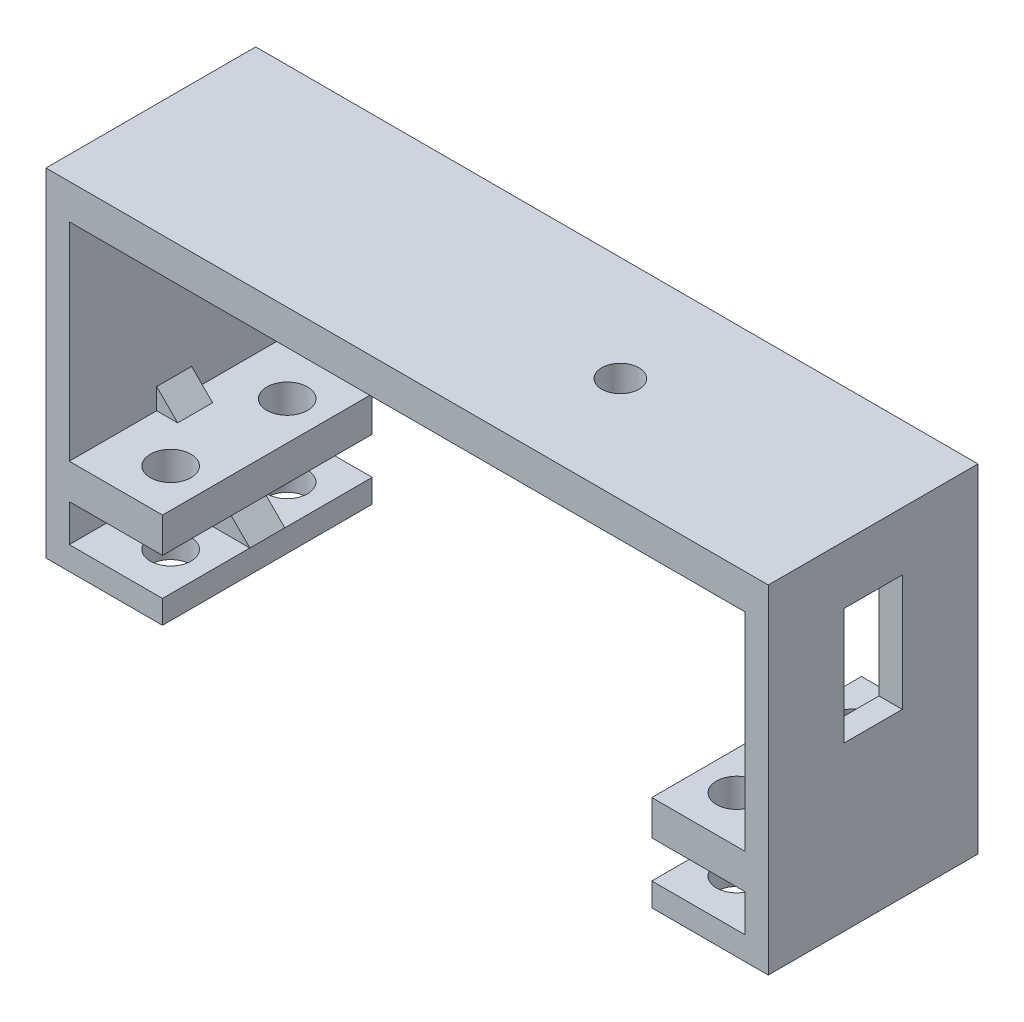
from build123d import *

# Parameters (mm, degrees)
RESSALTO_EXTRUS_O1_DEPTH = 9
ESBO_O2_R                = 1.75
CORTE_EXTRUS_O1_DEPTH    = 16
RESSALTO_EXTRUS_O3_DEPTH = 1.5
ESBO_O6_R                = 1.6
CORTE_EXTRUS_O2_DEPTH    = 3
ESBO_O7_W                = 5
ESBO_O7_H                = 10
CORTE_EXTRUS_O3_DEPTH    = 10
RESSALTO_EXTRUS_O4_START = 3.2
ESBO_O8_W                = 8
ESBO_O8_H                = 18
ESBO_O8_R                = 1.75
RESSALTO_EXTRUS_O4_DEPTH = 3


with BuildPart() as part:
    # Esboço1 → Ressalto-extrusão1 (new, symmetric)
    with BuildSketch(Plane.XY):
        Polygon((-21, 0), (-31, 0), (-31, 29), (31, 29), (31, 0), (21, 0), (21, 2), (29, 2), (29, 26), (-29, 26), (-29, 2), (-21, 2), align=None)
    extrude(amount=RESSALTO_EXTRUS_O1_DEPTH, both=True)

    # Esboço2 → Corte-extrusão1 (cut)
    with BuildSketch(Plane.XZ):
        with Locations(Location((-24.3, -5, 0), (0, 0, 270))):
            Circle(ESBO_O2_R)
        with Locations(Location((-24.3, 5, 0), (0, 0, 270))):
            Circle(ESBO_O2_R)
        with Locations(Location((24.3, 5, 0), (0, 0, 270))):
            Circle(ESBO_O2_R)
        with Locations(Location((24.3, -5, 0), (0, 0, 270))):
            Circle(ESBO_O2_R)
    extrude(amount=-CORTE_EXTRUS_O1_DEPTH, mode=Mode.SUBTRACT)

    # Esboço4 → Ressalto-extrusão3 (add, symmetric)
    with BuildSketch(Plane.XY):
        Polygon((-21, 2), (-29, 10), (-29, 2), align=None)
        Polygon((21, 2), (29, 2), (29, 10), align=None)
    extrude(amount=RESSALTO_EXTRUS_O3_DEPTH, both=True)

    # Esboço6 → Corte-extrusão2 (cut)
    with BuildSketch(Plane(origin=(0, 29, 0), x_dir=(1, 0, 0), z_dir=(0, 1, 0))):
        with Locations(Location((9.3, 0, 0), (0, 0, 270))):
            Circle(ESBO_O6_R)
    extrude(amount=-CORTE_EXTRUS_O2_DEPTH, mode=Mode.SUBTRACT)

    # Esboço7 → Corte-extrusão3 (cut)
    with BuildSketch(Plane(origin=(31, 0, 0), x_dir=(0, 0, -1), z_dir=(1, 0, 0))):
        with Locations((0, 19)):
            Rectangle(ESBO_O7_W, ESBO_O7_H)
    extrude(amount=-CORTE_EXTRUS_O3_DEPTH, mode=Mode.SUBTRACT)

    # Esboço8 → Ressalto-extrusão4 (add)
    # profile 1 of 2: a face of its own
    with BuildSketch(Plane(origin=(0, 2, 0), x_dir=(1, 0, 0), z_dir=(0, 1, 0)).offset(RESSALTO_EXTRUS_O4_START)):
        with Locations((-25, 0)):
            Rectangle(ESBO_O8_W, ESBO_O8_H)
        with Locations(Location((-24.3, -5, 0), (0, 0, 90))):
            Circle(ESBO_O8_R, mode=Mode.SUBTRACT)
        with Locations(Location((-24.3, 5, 0), (0, 0, 90))):
            Circle(ESBO_O8_R, mode=Mode.SUBTRACT)
    # profile 2 of 2: a face of its own
    with BuildSketch(Plane(origin=(0, 2, 0), x_dir=(1, 0, 0), z_dir=(0, 1, 0)).offset(RESSALTO_EXTRUS_O4_START)):
        with Locations((25, 0)):
            Rectangle(ESBO_O8_W, ESBO_O8_H)
        with Locations(Location((24.3, -5, 0), (0, 0, 90))):
            Circle(ESBO_O8_R, mode=Mode.SUBTRACT)
        with Locations(Location((24.3, 5, 0), (0, 0, 90))):
            Circle(ESBO_O8_R, mode=Mode.SUBTRACT)
    extrude(amount=RESSALTO_EXTRUS_O4_DEPTH)


solid = part.part
